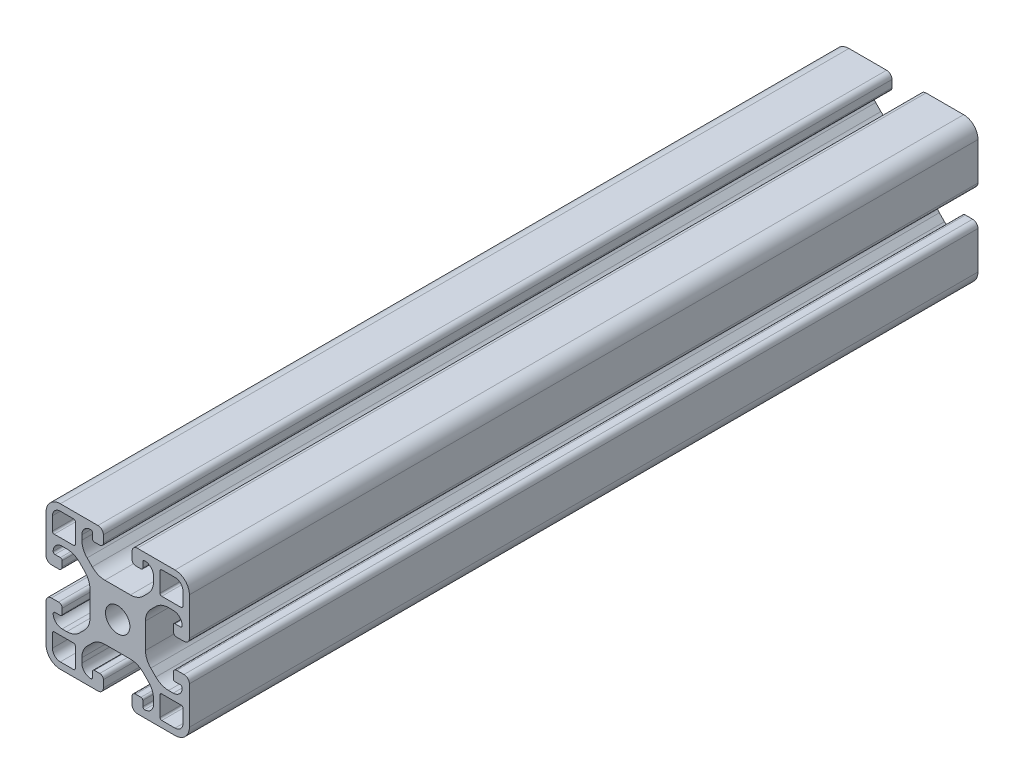
from build123d import *

# Parameters (mm, degrees)
ESQUISSE1_R        = 3.4
BOSS_EXTRU_1_DEPTH = 220


with BuildPart() as part:
    # Esquisse1 → Boss.-Extru.1 (new body)
    with BuildSketch(Plane(origin=(0, 0, -30), x_dir=(-1, 0, 0), z_dir=(0, 0, -1))):
        with BuildLine():
            Line((-4.5, 15), (-4.5, 13.5))
            ThreePointArc((-4.5, 13.5), (-4.353553391, 13.146446609), (-4, 13))
            Line((-4, 13), (-2.5, 13))
            ThreePointArc((-2.5, 13), (-2.146446609, 12.853553391), (-2, 12.5))
            ThreePointArc((-2, 12.5), (-2.732233047, 10.732233047), (-4.5, 10))
            Line((-4.5, 10), (-5.807611845, 10))
            ThreePointArc((-5.807611845, 10), (-7.721029006, 10.380602337), (-9.343145751, 11.464466094))
            Line((-9.343145751, 11.464466094), (-10.785533906, 12.906854249))
            ThreePointArc((-10.785533906, 12.906854249), (-11.869397663, 14.528970994), (-12.25, 16.442388155))
            Line((-12.25, 16.442388155), (-12.25, 23.557611845))
            ThreePointArc((-12.25, 23.557611845), (-11.869397663, 25.471029006), (-10.785533906, 27.093145751))
            Line((-10.785533906, 27.093145751), (-9.343145751, 28.535533906))
            ThreePointArc((-9.343145751, 28.535533906), (-7.721029006, 29.619397663), (-5.807611845, 30))
            Line((-5.807611845, 30), (-4.5, 30))
            ThreePointArc((-4.5, 30), (-2.732233047, 29.267766953), (-2, 27.5))
            ThreePointArc((-2, 27.5), (-2.146446609, 27.146446609), (-2.5, 27))
            Line((-2.5, 27), (-4, 27))
            ThreePointArc((-4, 27), (-4.353553391, 26.853553391), (-4.5, 26.5))
            Line((-4.5, 26.5), (-4.5, 25))
            ThreePointArc((-4.5, 25), (-4.207106781, 24.292893219), (-3.5, 24))
            Line((-3.5, 24), (-1.5, 24))
            ThreePointArc((-1.5, 24), (-0.439339828, 24.439339828), (0, 25.5))
            Line((0, 25.5), (0, 36))
            ThreePointArc((0, 36), (-1.171572875, 38.828427125), (-4, 40))
            Line((-4, 40), (-14.5, 40))
            ThreePointArc((-14.5, 40), (-15.560660172, 39.560660172), (-16, 38.5))
            Line((-16, 38.5), (-16, 36.5))
            ThreePointArc((-16, 36.5), (-15.707106781, 35.792893219), (-15, 35.5))
            Line((-15, 35.5), (-13.5, 35.5))
            ThreePointArc((-13.5, 35.5), (-13.146446609, 35.646446609), (-13, 36))
            Line((-13, 36), (-13, 37.5))
            ThreePointArc((-13, 37.5), (-12.853553391, 37.853553391), (-12.5, 38))
            ThreePointArc((-12.5, 38), (-10.732233047, 37.267766953), (-10, 35.5))
            Line((-10, 35.5), (-10, 34.192388155))
            ThreePointArc((-10, 34.192388155), (-10.380602337, 32.278970994), (-11.464466094, 30.656854249))
            Line((-11.464466094, 30.656854249), (-12.906854249, 29.214466094))
            ThreePointArc((-12.906854249, 29.214466094), (-14.528970994, 28.130602337), (-16.442388155, 27.75))
            Line((-16.442388155, 27.75), (-23.557611845, 27.75))
            ThreePointArc((-23.557611845, 27.75), (-25.471029006, 28.130602337), (-27.093145751, 29.214466094))
            Line((-27.093145751, 29.214466094), (-28.535533906, 30.656854249))
            ThreePointArc((-28.535533906, 30.656854249), (-29.619397663, 32.278970994), (-30, 34.192388155))
            Line((-30, 34.192388155), (-30, 35.5))
            ThreePointArc((-30, 35.5), (-29.267766953, 37.267766953), (-27.5, 38))
            ThreePointArc((-27.5, 38), (-27.146446609, 37.853553391), (-27, 37.5))
            Line((-27, 37.5), (-27, 36))
            ThreePointArc((-27, 36), (-26.853553391, 35.646446609), (-26.5, 35.5))
            Line((-26.5, 35.5), (-25, 35.5))
            ThreePointArc((-25, 35.5), (-24.292893219, 35.792893219), (-24, 36.5))
            Line((-24, 36.5), (-24, 38.5))
            ThreePointArc((-24, 38.5), (-24.439339828, 39.560660172), (-25.5, 40))
            Line((-25.5, 40), (-36, 40))
            ThreePointArc((-36, 40), (-38.828427125, 38.828427125), (-40, 36))
            Line((-40, 36), (-40, 25.5))
            ThreePointArc((-40, 25.5), (-39.560660172, 24.439339828), (-38.5, 24))
            Line((-38.5, 24), (-36.5, 24))
            ThreePointArc((-36.5, 24), (-35.792893219, 24.292893219), (-35.5, 25))
            Line((-35.5, 25), (-35.5, 26.5))
            ThreePointArc((-35.5, 26.5), (-35.646446609, 26.853553391), (-36, 27))
            Line((-36, 27), (-37.5, 27))
            ThreePointArc((-37.5, 27), (-37.853553391, 27.146446609), (-38, 27.5))
            ThreePointArc((-38, 27.5), (-37.267766953, 29.267766953), (-35.5, 30))
            Line((-35.5, 30), (-34.192388155, 30))
            ThreePointArc((-34.192388155, 30), (-32.278970994, 29.619397663), (-30.656854249, 28.535533906))
            Line((-30.656854249, 28.535533906), (-29.214466094, 27.093145751))
            ThreePointArc((-29.214466094, 27.093145751), (-28.130602337, 25.471029006), (-27.75, 23.557611845))
            Line((-27.75, 23.557611845), (-27.75, 16.442388155))
            ThreePointArc((-27.75, 16.442388155), (-28.130602337, 14.528970994), (-29.214466094, 12.906854249))
            Line((-29.214466094, 12.906854249), (-30.656854249, 11.464466094))
            ThreePointArc((-30.656854249, 11.464466094), (-32.278970994, 10.380602337), (-34.192388155, 10))
            Line((-34.192388155, 10), (-35.5, 10))
            ThreePointArc((-35.5, 10), (-37.267766953, 10.732233047), (-38, 12.5))
            ThreePointArc((-38, 12.5), (-37.853553391, 12.853553391), (-37.5, 13))
            Line((-37.5, 13), (-36, 13))
            ThreePointArc((-36, 13), (-35.646446609, 13.146446609), (-35.5, 13.5))
            Line((-35.5, 13.5), (-35.5, 15))
            ThreePointArc((-35.5, 15), (-35.792893219, 15.707106781), (-36.5, 16))
            Line((-36.5, 16), (-38.5, 16))
            ThreePointArc((-38.5, 16), (-39.560660172, 15.560660172), (-40, 14.5))
            Line((-40, 14.5), (-40, 4))
            ThreePointArc((-40, 4), (-38.828427125, 1.171572875), (-36, 0))
            Line((-36, 0), (-25.5, 0))
            ThreePointArc((-25.5, 0), (-24.439339828, 0.439339828), (-24, 1.5))
            Line((-24, 1.5), (-24, 3.5))
            ThreePointArc((-24, 3.5), (-24.292893219, 4.207106781), (-25, 4.5))
            Line((-25, 4.5), (-26.5, 4.5))
            ThreePointArc((-26.5, 4.5), (-26.853553391, 4.353553391), (-27, 4))
            Line((-27, 4), (-27, 2.5))
            ThreePointArc((-27, 2.5), (-27.146446609, 2.146446609), (-27.5, 2))
            ThreePointArc((-27.5, 2), (-29.267766953, 2.732233047), (-30, 4.5))
            Line((-30, 4.5), (-30, 5.807611845))
            ThreePointArc((-30, 5.807611845), (-29.619397663, 7.721029006), (-28.535533906, 9.343145751))
            Line((-28.535533906, 9.343145751), (-27.093145751, 10.785533906))
            ThreePointArc((-27.093145751, 10.785533906), (-25.471029006, 11.869397663), (-23.557611845, 12.25))
            Line((-23.557611845, 12.25), (-16.442388155, 12.25))
            ThreePointArc((-16.442388155, 12.25), (-14.528970994, 11.869397663), (-12.906854249, 10.785533906))
            Line((-12.906854249, 10.785533906), (-11.464466094, 9.343145751))
            ThreePointArc((-11.464466094, 9.343145751), (-10.380602337, 7.721029006), (-10, 5.807611845))
            Line((-10, 5.807611845), (-10, 4.5))
            ThreePointArc((-10, 4.5), (-10.732233047, 2.732233047), (-12.5, 2))
            ThreePointArc((-12.5, 2), (-12.853553391, 2.146446609), (-13, 2.5))
            Line((-13, 2.5), (-13, 4))
            ThreePointArc((-13, 4), (-13.146446609, 4.353553391), (-13.5, 4.5))
            Line((-13.5, 4.5), (-15, 4.5))
            ThreePointArc((-15, 4.5), (-15.707106781, 4.207106781), (-16, 3.5))
            Line((-16, 3.5), (-16, 1.5))
            ThreePointArc((-16, 1.5), (-15.560660172, 0.439339828), (-14.5, 0))
            Line((-14.5, 0), (-4, 0))
            ThreePointArc((-4, 0), (-1.171572875, 1.171572875), (0, 4))
            Line((0, 4), (0, 14.5))
            ThreePointArc((0, 14.5), (-0.439339828, 15.560660172), (-1.5, 16))
            Line((-1.5, 16), (-3.5, 16))
            ThreePointArc((-3.5, 16), (-4.207106781, 15.707106781), (-4.5, 15))
        make_face()
        with Locations(Location((-20, 20, 0), (0, 0, 180))):
            Circle(ESQUISSE1_R, mode=Mode.SUBTRACT)
        with BuildLine():
            Line((-4, 1.8), (-7.7, 1.8))
            ThreePointArc((-7.7, 1.8), (-8.053553391, 1.946446609), (-8.2, 2.3))
            Line((-8.2, 2.3), (-8.2, 7.7))
            ThreePointArc((-8.2, 7.7), (-8.053553391, 8.053553391), (-7.7, 8.2))
            Line((-7.7, 8.2), (-2.3, 8.2))
            ThreePointArc((-2.3, 8.2), (-1.946446609, 8.053553391), (-1.8, 7.7))
            Line((-1.8, 7.7), (-1.8, 4))
            ThreePointArc((-1.8, 4), (-2.444365081, 2.444365081), (-4, 1.8))
        make_face(mode=Mode.SUBTRACT)
        with BuildLine():
            Line((-38.2, 4), (-38.2, 7.7))
            ThreePointArc((-38.2, 7.7), (-38.053553391, 8.053553391), (-37.7, 8.2))
            Line((-37.7, 8.2), (-32.3, 8.2))
            ThreePointArc((-32.3, 8.2), (-31.946446609, 8.053553391), (-31.8, 7.7))
            Line((-31.8, 7.7), (-31.8, 2.3))
            ThreePointArc((-31.8, 2.3), (-31.946446609, 1.946446609), (-32.3, 1.8))
            Line((-32.3, 1.8), (-36, 1.8))
            ThreePointArc((-36, 1.8), (-37.555634919, 2.444365081), (-38.2, 4))
        make_face(mode=Mode.SUBTRACT)
        with BuildLine():
            Line((-36, 38.2), (-32.3, 38.2))
            ThreePointArc((-32.3, 38.2), (-31.946446609, 38.053553391), (-31.8, 37.7))
            Line((-31.8, 37.7), (-31.8, 32.3))
            ThreePointArc((-31.8, 32.3), (-31.946446609, 31.946446609), (-32.3, 31.8))
            Line((-32.3, 31.8), (-37.7, 31.8))
            ThreePointArc((-37.7, 31.8), (-38.053553391, 31.946446609), (-38.2, 32.3))
            Line((-38.2, 32.3), (-38.2, 36))
            ThreePointArc((-38.2, 36), (-37.555634919, 37.555634919), (-36, 38.2))
        make_face(mode=Mode.SUBTRACT)
        with BuildLine():
            Line((-1.8, 36), (-1.8, 32.3))
            ThreePointArc((-1.8, 32.3), (-1.946446609, 31.946446609), (-2.3, 31.8))
            Line((-2.3, 31.8), (-7.7, 31.8))
            ThreePointArc((-7.7, 31.8), (-8.053553391, 31.946446609), (-8.2, 32.3))
            Line((-8.2, 32.3), (-8.2, 37.7))
            ThreePointArc((-8.2, 37.7), (-8.053553391, 38.053553391), (-7.7, 38.2))
            Line((-7.7, 38.2), (-4, 38.2))
            ThreePointArc((-4, 38.2), (-2.444365081, 37.555634919), (-1.8, 36))
        make_face(mode=Mode.SUBTRACT)
    extrude(amount=-BOSS_EXTRU_1_DEPTH)


solid = part.part
